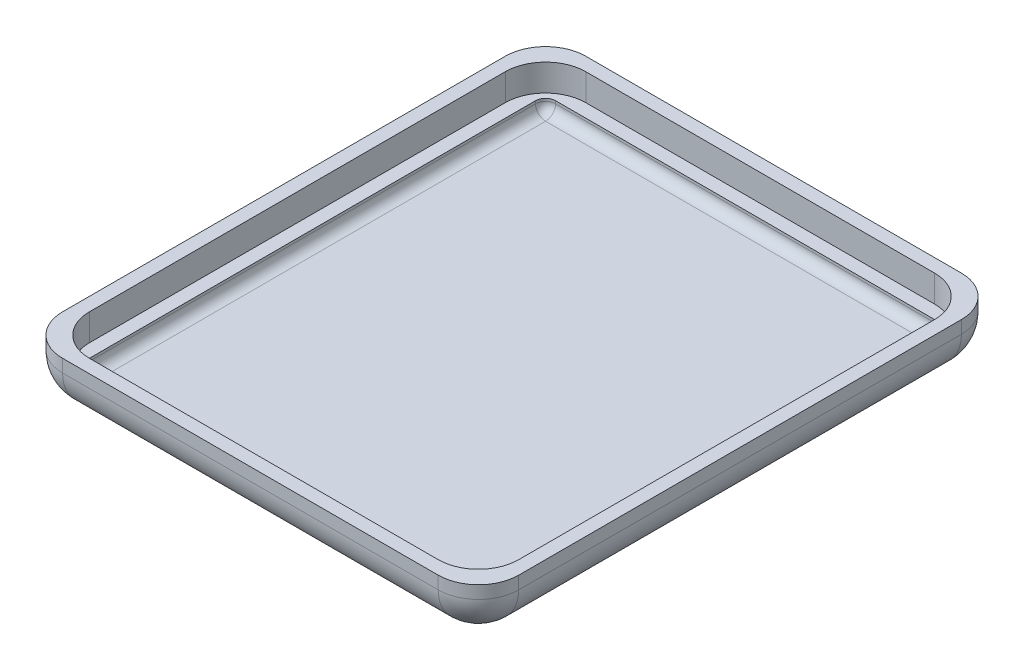
from build123d import *

# Parameters (mm, degrees)
SCHIZZO1_W                   = 34
SCHIZZO1_H                   = 39
ESTRUSIONE_ESTRUSIONE1_DEPTH = 3.95
SCHIZZO2_W                   = 32
SCHIZZO2_H                   = 37
TAGLIO_ESTRUSIONE1_DEPTH     = 2
SCHIZZO3_W                   = 30
SCHIZZO3_H                   = 35
TAGLIO_ESTRUSIONE2_DEPTH     = 0.95
RACCORDO1_R                  = 3
RACCORDO2_R                  = 0.75


with BuildPart() as part:
    # Schizzo1 → Estrusione-Estrusione1 (new body)
    with BuildSketch(Plane(origin=(0, 0, 0), x_dir=(1, 0, 0), z_dir=(0, 1, 0))):
        with Locations((-13.327421164, 1.628483957)):
            Rectangle(SCHIZZO1_W, SCHIZZO1_H)
    extrude(amount=ESTRUSIONE_ESTRUSIONE1_DEPTH)

    # Schizzo2 → Taglio-Estrusione1 (cut)
    with BuildSketch(Plane(origin=(0, 3.95, 0), x_dir=(1, 0, 0), z_dir=(0, 1, 0))):
        with Locations((-13.327421164, 1.628483957)):
            Rectangle(SCHIZZO2_W, SCHIZZO2_H)
    extrude(amount=-TAGLIO_ESTRUSIONE1_DEPTH, mode=Mode.SUBTRACT)

    # Schizzo3 → Taglio-Estrusione2 (cut)
    with BuildSketch(Plane(origin=(0, 1.95, 0), x_dir=(1, 0, 0), z_dir=(0, 1, 0))):
        with Locations((-13.327421164, 1.628483957)):
            Rectangle(SCHIZZO3_W, SCHIZZO3_H)
    extrude(amount=-TAGLIO_ESTRUSIONE2_DEPTH, mode=Mode.SUBTRACT)

    # Raccordo1
    raccordo1_edges = [part.edges().sort_by_distance(p)[0] for p in [
        (-29.327421164, 2.95, 16.871516043),
        (-29.327421164, 2.95, -20.128483957),
        (2.672578836, 2.95, -20.128483957),
        (2.672578836, 2.95, 16.871516043),
        (-13.327421164, 0, -21.128483957),
        (3.672578836, 0, -1.628483957),
        (-13.327421164, 0, 17.871516043),
        (-30.327421164, 0, -1.628483957),
        (-30.327421164, 1.975, -21.128483957),
        (3.672578836, 1.975, -21.128483957),
        (3.672578836, 1.975, 17.871516043),
        (-30.327421164, 1.975, 17.871516043),
    ]]
    fillet(raccordo1_edges, radius=RACCORDO1_R)

    # Raccordo2
    raccordo2_edges = [part.edges().sort_by_distance(p)[0] for p in [
        (-28.327421164, 1, -1.628483957),
        (-28.327421164, 1.475, 15.871516043),
        (-13.327421164, 1, -19.128483957),
        (-28.327421164, 1.475, -19.128483957),
        (1.672578836, 1, -1.628483957),
        (1.672578836, 1.475, -19.128483957),
        (-13.327421164, 1, 15.871516043),
        (1.672578836, 1.475, 15.871516043),
    ]]
    fillet(raccordo2_edges, radius=RACCORDO2_R)


solid = part.part
